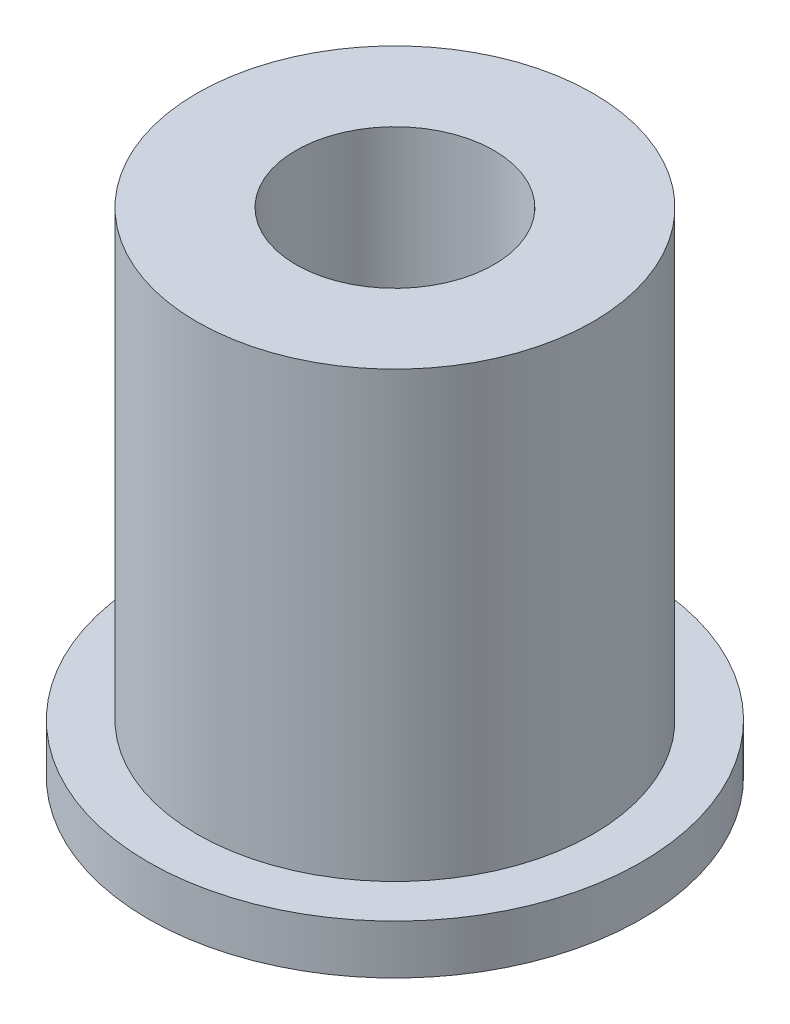
from build123d import *

# Parameters (mm, degrees)
SKETCH2_R           = 6.3754
SKETCH2_R_2         = 3.1877
BOSS_EXTRUDE1_DEPTH = 15.875
SKETCH3_R           = 7.9375
SKETCH3_R_2         = 6.3754
BOSS_EXTRUDE2_DEPTH = 1.5875


with BuildPart() as part:
    # Sketch2 → Boss-Extrude1 (new body)
    with BuildSketch(Plane(origin=(0, 0, 0), x_dir=(1, 0, 0), z_dir=(0, 1, 0))):
        with Locations(Location((0, 0, 0), (0, 0, 270))):
            Circle(SKETCH2_R)
        with Locations(Location((0, 0, 0), (0, 0, 270))):
            Circle(SKETCH2_R_2, mode=Mode.SUBTRACT)
    extrude(amount=BOSS_EXTRUDE1_DEPTH)

    # Sketch3 → Boss-Extrude2 (add)
    with BuildSketch(Plane(origin=(0, 0, 0), x_dir=(1, 0, 0), z_dir=(0, 1, 0))):
        with Locations(Location((0, 0, 0), (0, 0, 270))):
            Circle(SKETCH3_R)
        with Locations(Location((0, 0, 0), (0, 0, 270))):
            Circle(SKETCH3_R_2, mode=Mode.SUBTRACT)
    extrude(amount=BOSS_EXTRUDE2_DEPTH)


solid = part.part
